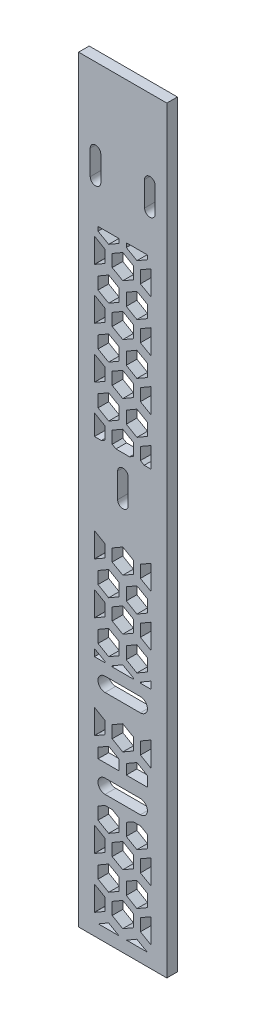
from build123d import *

# Parameters (mm, degrees)
SKETCH1_W           = 25
SKETCH1_H           = 229.0607495
SKETCH1_R           = 1.5
BOSS_EXTRUDE1_DEPTH = 3
CUT_EXTRUDE1_DEPTH  = 118.265539563
CUT_EXTRUDE2_DEPTH  = 118.265539563
CUT_EXTRUDE3_DEPTH  = 10
SKETCH5_W           = 25
SKETCH5_H           = 14.4207495
CUT_EXTRUDE4_DEPTH  = 118.265539563


with BuildPart() as part:
    # Sketch1 → Boss-Extrude1 (new body)
    with BuildSketch(Plane.XY):
        with Locations((12.5, 0)):
            Rectangle(SKETCH1_W, SKETCH1_H)
        with Locations((4.8, 89.13037475)):
            Circle(SKETCH1_R, mode=Mode.SUBTRACT)
        with Locations((20.2, 89.13037475)):
            Circle(SKETCH1_R, mode=Mode.SUBTRACT)
        with Locations((12.55876, 13.772227202)):
            Circle(SKETCH1_R, mode=Mode.SUBTRACT)
        with BuildLine():
            add(Edge.make_bspline(
                [(11.075, -109.328089672), (11.075, -112.328089671), (14.075, -112.328089671), (14.075, -109.328089672), (14.075, -106.328089673), (11.075, -106.328089673), (11.075, -109.328089672)],
                knots=[0, 0, 0, 0, 0.5, 0.5, 0.5, 1, 1, 1, 1], degree=3, weights=[1, 0.333333333, 0.333333333, 1, 0.333333333, 0.333333333, 1]))
        make_face(mode=Mode.SUBTRACT)
    extrude(amount=BOSS_EXTRUDE1_DEPTH)

    # Sketch2 → Cut-Extrude1 (cut, through all)
    with BuildSketch(Plane.XY.offset(3)):
        with BuildLine():
            Line((7.5, -34.813160449), (17.5, -34.813160449))
            ThreePointArc((17.5, -34.813160449), (19.5, -36.813160449), (17.5, -38.813160449))
            Line((17.5, -38.813160449), (7.5, -38.813160449))
            ThreePointArc((7.5, -38.813160449), (5.5, -36.813160449), (7.5, -34.813160449))
        make_face()
        with BuildLine():
            Line((7.5, -63.813160449), (17.5, -63.813160449))
            ThreePointArc((17.5, -63.813160449), (19.5, -61.813160449), (17.5, -59.813160449))
            Line((17.5, -59.813160449), (7.5, -59.813160449))
            ThreePointArc((7.5, -59.813160449), (5.5, -61.813160449), (7.5, -63.813160449))
        make_face()
    extrude(amount=-CUT_EXTRUDE1_DEPTH, mode=Mode.SUBTRACT)

    # Sketch3 → Cut-Extrude2 (cut, through all)
    with BuildSketch(Plane.XY.offset(3)):
        with BuildLine():
            Line((6.3, 92.63037475), (6.3, 85.63037475))
            ThreePointArc((6.3, 85.63037475), (4.8, 84.13037475), (3.3, 85.63037475))
            Line((3.3, 85.63037475), (3.3, 92.63037475))
            ThreePointArc((3.3, 92.63037475), (4.8, 94.13037475), (6.3, 92.63037475))
        make_face()
        with BuildLine():
            Line((18.7, 92.63037475), (18.7, 85.63037475))
            ThreePointArc((18.7, 85.63037475), (20.2, 84.13037475), (21.7, 85.63037475))
            Line((21.7, 85.63037475), (21.7, 92.63037475))
            ThreePointArc((21.7, 92.63037475), (20.2, 94.13037475), (18.7, 92.63037475))
        make_face()
        with BuildLine():
            Line((14.05876, 17.272227202), (14.05876, 10.272227202))
            ThreePointArc((14.05876, 10.272227202), (12.55876, 8.772227202), (11.05876, 10.272227202))
            Line((11.05876, 10.272227202), (11.05876, 17.272227202))
            ThreePointArc((11.05876, 17.272227202), (12.55876, 18.772227202), (14.05876, 17.272227202))
        make_face()
    extrude(amount=-CUT_EXTRUDE2_DEPTH, mode=Mode.SUBTRACT)

    # Sketch4 → Cut-Extrude3 (cut)
    with BuildSketch(Plane.XY.offset(3)):
        Polygon((8.520355389, -94.839847362), (5.59227606, -96.53037475), (11.448434718, -96.53037475), align=None)
        Polygon((16.520355389, -94.839847362), (13.59227606, -96.53037475), (19.448434718, -96.53037475), align=None)
        Polygon((20.5, -94.234501633), (20.5, -87.329802781), (17.520355389, -89.050101399), (17.520355389, -92.514203015), align=None)
        Polygon((9.520355389, -92.514203015), (12.520355389, -94.246253822), (15.520355389, -92.514203015), (15.520355389, -89.050101399), (12.520355389, -87.318050592), (9.520355389, -89.050101399), align=None)
        Polygon((4.520355389, -87.318050592), (4.5, -87.329802781), (4.5, -94.234501633), (4.520355389, -94.246253822), (7.520355389, -92.514203015), (7.520355389, -89.050101399), align=None)
        Polygon((5.520355389, -85.585999784), (8.520355389, -87.318050592), (11.520355389, -85.585999784), (11.520355389, -82.121898169), (8.520355389, -80.389847362), (5.520355389, -82.121898169), align=None)
        Polygon((13.520355389, -85.585999784), (16.520355389, -87.318050592), (19.520355389, -85.585999784), (19.520355389, -82.121898169), (16.520355389, -80.389847362), (13.520355389, -82.121898169), align=None)
        Polygon((20.5, -79.784501633), (20.5, -72.879802781), (17.520355389, -74.600101399), (17.520355389, -78.064203015), align=None)
        Polygon((9.520355389, -78.064203015), (12.520355389, -79.796253822), (15.520355389, -78.064203015), (15.520355389, -74.600101399), (12.520355389, -72.868050592), (9.520355389, -74.600101399), align=None)
        Polygon((4.520355389, -72.868050592), (4.5, -72.879802781), (4.5, -79.784501633), (4.520355389, -79.796253822), (7.520355389, -78.064203015), (7.520355389, -74.600101399), align=None)
        Polygon((17.54317883, -66.53037475), (15.497531948, -66.53037475), (13.520355389, -67.671898169), (13.520355389, -71.135999784), (16.520355389, -72.868050592), (19.520355389, -71.135999784), (19.520355389, -67.671898169), align=None)
        Polygon((9.54317883, -66.53037475), (7.497531948, -66.53037475), (5.520355389, -67.671898169), (5.520355389, -71.135999784), (8.520355389, -72.868050592), (11.520355389, -71.135999784), (11.520355389, -67.671898169), align=None)
        Polygon((5.520355389, -53.221898169), (5.520355389, -56.071638707), (11.520355389, -56.071638707), (11.520355389, -53.221898169), (8.520355389, -51.489847362), align=None)
        Polygon((13.520355389, -53.221898169), (13.520355389, -56.071638707), (19.520355389, -56.071638707), (19.520355389, -53.221898169), (16.520355389, -51.489847362), align=None)
        Polygon((20.5, -50.884501633), (20.5, -43.979802781), (17.520355389, -45.700101399), (17.520355389, -49.164203015), align=None)
        Polygon((9.520355389, -49.164203015), (12.520355389, -50.896253822), (15.520355389, -49.164203015), (15.520355389, -45.700101399), (12.520355389, -43.968050592), (9.520355389, -45.700101399), align=None)
        Polygon((4.520355389, -43.968050592), (4.5, -43.979802781), (4.5, -50.884501633), (4.520355389, -50.896253822), (7.520355389, -49.164203015), (7.520355389, -45.700101399), align=None)
        Polygon((4.5, -29.529802781), (4.5, -31.53037475), (7.520355389, -31.53037475), (7.520355389, -31.250101399), (4.520355389, -29.518050592), align=None)
        Polygon((9.520355389, -31.250101399), (9.520355389, -31.53037475), (15.520355389, -31.53037475), (15.520355389, -31.250101399), (12.520355389, -29.518050592), align=None)
        Polygon((17.520355389, -31.250101399), (17.520355389, -31.53037475), (20.5, -31.53037475), (20.5, -29.529802781), align=None)
        Polygon((13.520355389, -27.785999784), (16.520355389, -29.518050592), (19.520355389, -27.785999784), (19.520355389, -24.321898169), (16.520355389, -22.589847362), (13.520355389, -24.321898169), align=None)
        Polygon((5.520355389, -27.785999784), (8.520355389, -29.518050592), (11.520355389, -27.785999784), (11.520355389, -24.321898169), (8.520355389, -22.589847362), (5.520355389, -24.321898169), align=None)
        Polygon((17.520355389, -20.264203015), (20.5, -21.984501633), (20.5, -15.079802781), (17.520355389, -16.800101399), align=None)
        Polygon((9.520355389, -20.264203015), (12.520355389, -21.996253822), (15.520355389, -20.264203015), (15.520355389, -16.800101399), (12.520355389, -15.068050592), (9.520355389, -16.800101399), align=None)
        Polygon((4.5, -15.079802781), (4.5, -21.984501633), (4.520355389, -21.996253822), (7.520355389, -20.264203015), (7.520355389, -16.800101399), (4.520355389, -15.068050592), align=None)
        Polygon((5.520355389, -13.335999784), (8.520355389, -15.068050592), (11.520355389, -13.335999784), (11.520355389, -9.871898169), (8.520355389, -8.139847362), (5.520355389, -9.871898169), align=None)
        Polygon((13.520355389, -13.335999784), (16.520355389, -15.068050592), (19.520355389, -13.335999784), (19.520355389, -9.871898169), (16.520355389, -8.139847362), (13.520355389, -9.871898169), align=None)
        Polygon((17.520355389, -5.814203015), (20.5, -7.534501633), (20.5, -0.629802781), (17.520355389, -2.350101399), align=None)
        Polygon((9.520355389, -5.814203015), (12.520355389, -7.546253822), (15.520355389, -5.814203015), (15.520355389, -2.350101399), (12.520355389, -0.618050592), (9.520355389, -2.350101399), align=None)
        Polygon((4.5, -0.629802781), (4.5, -7.534501633), (4.520355389, -7.546253822), (7.520355389, -5.814203015), (7.520355389, -2.350101399), (4.520355389, -0.618050592), align=None)
        Polygon((4.5, 28.270197219), (4.5, 22.46962525), (6.453114636, 22.46962525), (7.520355389, 23.085796985), (7.520355389, 26.549898601), (4.520355389, 28.281949408), align=None)
        Polygon((9.520355389, 23.085796985), (10.587596142, 22.46962525), (14.453114636, 22.46962525), (15.520355389, 23.085796985), (15.520355389, 26.549898601), (12.520355389, 28.281949408), (9.520355389, 26.549898601), align=None)
        Polygon((17.520355389, 23.085796985), (18.587596142, 22.46962525), (20.5, 22.46962525), (20.5, 28.270197219), (17.520355389, 26.549898601), align=None)
        Polygon((13.520355389, 30.014000216), (16.520355389, 28.281949408), (19.520355389, 30.014000216), (19.520355389, 33.478101831), (16.520355389, 35.210152638), (13.520355389, 33.478101831), align=None)
        Polygon((5.520355389, 30.014000216), (8.520355389, 28.281949408), (11.520355389, 30.014000216), (11.520355389, 33.478101831), (8.520355389, 35.210152638), (5.520355389, 33.478101831), align=None)
        Polygon((17.520355389, 37.535796985), (20.5, 35.815498367), (20.5, 42.720197219), (17.520355389, 40.999898601), align=None)
        Polygon((9.520355389, 37.535796985), (12.520355389, 35.803746178), (15.520355389, 37.535796985), (15.520355389, 40.999898601), (12.520355389, 42.731949408), (9.520355389, 40.999898601), align=None)
        Polygon((4.5, 42.720197219), (4.5, 35.815498367), (4.520355389, 35.803746178), (7.520355389, 37.535796985), (7.520355389, 40.999898601), (4.520355389, 42.731949408), align=None)
        Polygon((5.520355389, 44.464000216), (8.520355389, 42.731949408), (11.520355389, 44.464000216), (11.520355389, 47.928101831), (8.520355389, 49.660152638), (5.520355389, 47.928101831), align=None)
        Polygon((13.520355389, 44.464000216), (16.520355389, 42.731949408), (19.520355389, 44.464000216), (19.520355389, 47.928101831), (16.520355389, 49.660152638), (13.520355389, 47.928101831), align=None)
        Polygon((17.520355389, 51.985796985), (20.5, 50.265498367), (20.5, 57.170197219), (17.520355389, 55.449898601), align=None)
        Polygon((9.520355389, 51.985796985), (12.520355389, 50.253746178), (15.520355389, 51.985796985), (15.520355389, 55.449898601), (12.520355389, 57.181949408), (9.520355389, 55.449898601), align=None)
        Polygon((4.5, 57.170197219), (4.5, 50.265498367), (4.520355389, 50.253746178), (7.520355389, 51.985796985), (7.520355389, 55.449898601), (4.520355389, 57.181949408), align=None)
        Polygon((5.520355389, 58.914000216), (8.520355389, 57.181949408), (11.520355389, 58.914000216), (11.520355389, 62.378101831), (8.520355389, 64.110152638), (5.520355389, 62.378101831), align=None)
        Polygon((13.520355389, 58.914000216), (16.520355389, 57.181949408), (19.520355389, 58.914000216), (19.520355389, 62.378101831), (16.520355389, 64.110152638), (13.520355389, 62.378101831), align=None)
        Polygon((17.520355389, 66.435796985), (20.5, 64.715498367), (20.5, 71.620197219), (17.520355389, 69.899898601), align=None)
        Polygon((9.520355389, 66.435796985), (12.520355389, 64.703746178), (15.520355389, 66.435796985), (15.520355389, 69.899898601), (12.520355389, 71.631949408), (9.520355389, 69.899898601), align=None)
        Polygon((4.5, 71.620197219), (4.5, 64.715498367), (4.520355389, 64.703746178), (7.520355389, 66.435796985), (7.520355389, 69.899898601), (4.520355389, 71.631949408), align=None)
        Polygon((11.520355389, 74.53037475), (5.520355389, 74.53037475), (5.520355389, 73.364000216), (8.520355389, 71.631949408), (11.520355389, 73.364000216), align=None)
        Polygon((19.520355389, 74.53037475), (13.520355389, 74.53037475), (13.520355389, 73.364000216), (16.520355389, 71.631949408), (19.520355389, 73.364000216), align=None)
    extrude(amount=-CUT_EXTRUDE3_DEPTH, mode=Mode.SUBTRACT)

    # Sketch5 → Cut-Extrude4 (cut, through all)
    with BuildSketch(Plane.XY.offset(3)):
        with Locations((12.5, -107.32)):
            Rectangle(SKETCH5_W, SKETCH5_H)
    extrude(amount=-CUT_EXTRUDE4_DEPTH, mode=Mode.SUBTRACT)


solid = part.part
